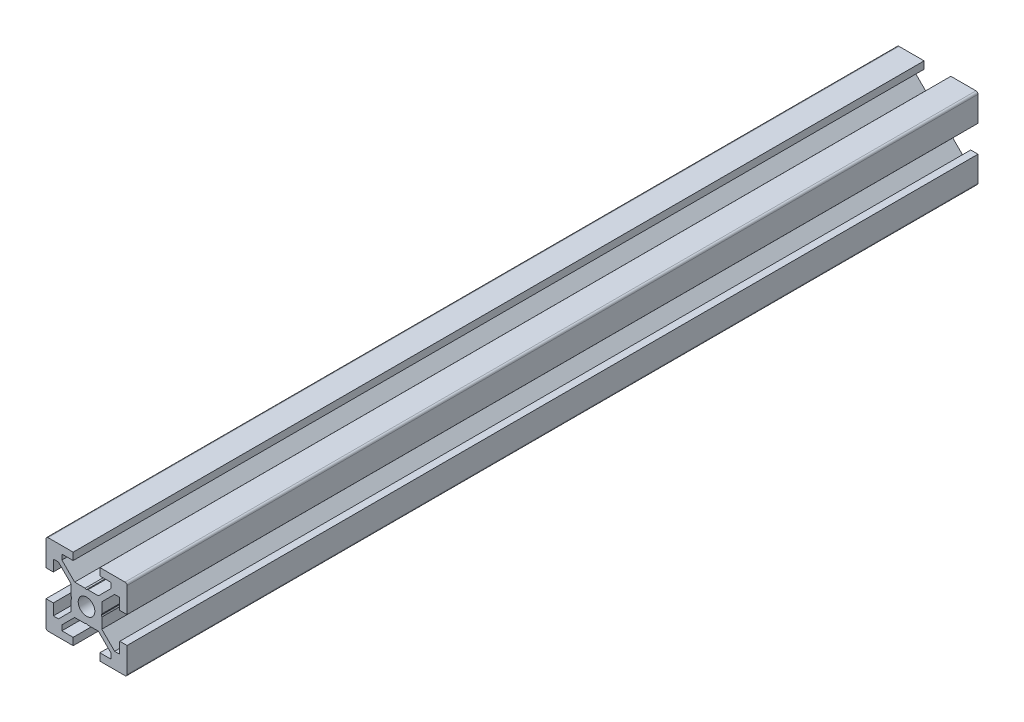
from build123d import *

# Parameters (mm, degrees)
SKETCH1_R           = 2.05
BOSS_EXTRUDE1_DEPTH = 210
FILLET1_R           = 0.5
CUT_EXTRUDE1_REACH  = 212.689
SKETCH2_R           = 2.25


with BuildPart() as part:
    # Sketch1 → Boss-Extrude1 (new body)
    with BuildSketch(Plane.XY):
        Polygon((-3.3, 10), (-3.3, 8.2), (-6.08, 8.2), (-6.08, 6.928528137), (-2.931471863, 3.78), (-0.34, 3.78), (0, 3.66), (0.34, 3.78), (2.931471863, 3.78), (6.08, 6.928528137), (6.08, 8.2), (3.3, 8.2), (3.3, 10), (10, 10), (10, 3.3), (8.2, 3.3), (8.2, 6.08), (6.928528137, 6.08), (3.78, 2.931471863), (3.78, 0.34), (3.66, 0), (3.78, -0.34), (3.78, -2.931471863), (6.928528137, -6.08), (8.2, -6.08), (8.2, -3.3), (10, -3.3), (10, -10), (3.3, -10), (3.3, -8.2), (6.08, -8.2), (6.08, -6.928528137), (2.931471863, -3.78), (0.34, -3.78), (0, -3.66), (-0.34, -3.78), (-2.931471863, -3.78), (-6.08, -6.928528137), (-6.08, -8.2), (-3.3, -8.2), (-3.3, -10), (-10, -10), (-10, -3.3), (-8.2, -3.3), (-8.2, -6.08), (-6.928528137, -6.08), (-3.78, -2.931471863), (-3.78, -0.34), (-3.66, 0), (-3.78, 0.34), (-3.78, 2.931471863), (-6.928528137, 6.08), (-8.2, 6.08), (-8.2, 3.3), (-10, 3.3), (-10, 10), align=None)
        Circle(SKETCH1_R, mode=Mode.SUBTRACT)
    extrude(amount=BOSS_EXTRUDE1_DEPTH)

    # Fillet1
    fillet1_edges = [part.edges().sort_by_distance(p)[0] for p in [
        (10, 10, 105),
        (10, -10, 105),
        (-10, -10, 105),
        (-10, 10, 105),
    ]]
    fillet(fillet1_edges, radius=FILLET1_R)

    # Sketch2 → Cut-Extrude1 (cut, up to next)
    with BuildSketch(Plane(origin=(3.78, 0, 0), x_dir=(0, 0, -1), z_dir=(1, 0, 0)), mode=Mode.PRIVATE) as cut_extrude1_sk1:
        with Locations(Location((-3.95, 0, 0), (0, 0, 8.691322554))):
            Circle(SKETCH2_R)
    cut_extrude1_tool1 = extrude(cut_extrude1_sk1.sketch, amount=-CUT_EXTRUDE1_REACH, mode=Mode.PRIVATE) & part.part
    # Sketch2 → Cut-Extrude1 (cut, up to next)
    with BuildSketch(Plane(origin=(3.78, 0, 0), x_dir=(0, 0, -1), z_dir=(1, 0, 0)), mode=Mode.PRIVATE) as cut_extrude1_sk2:
        with Locations(Location((-52.55, 0, 0), (0, 0, 171.308677446))):
            Circle(SKETCH2_R)
    cut_extrude1_tool2 = extrude(cut_extrude1_sk2.sketch, amount=-CUT_EXTRUDE1_REACH, mode=Mode.PRIVATE) & part.part
    add(cut_extrude1_tool1.solids().sort_by_distance((3.78, 0, 3.95))[0], mode=Mode.SUBTRACT)
    add(cut_extrude1_tool2.solids().sort_by_distance((3.78, 0, 52.55))[0], mode=Mode.SUBTRACT)


solid = part.part
